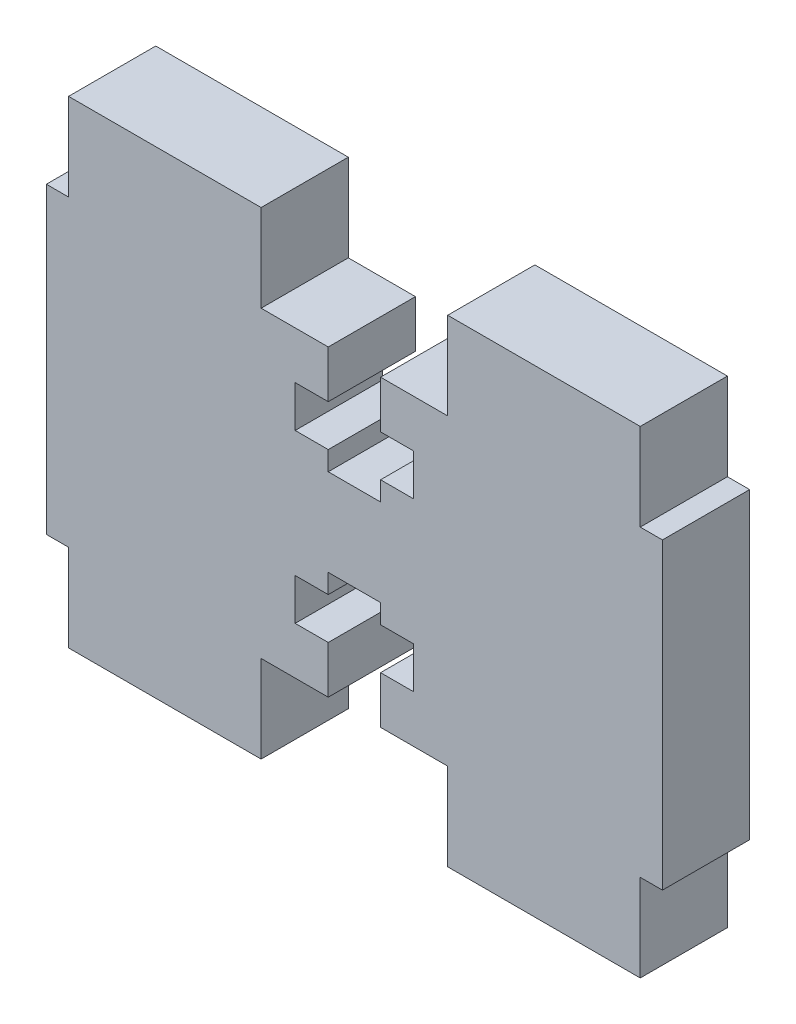
from build123d import *

# Parameters (mm, degrees)
BOSS_EXTRUDE1_DEPTH = 5.842


with BuildPart() as part:
    # Sketch1 → Boss-Extrude1 (new body)
    with BuildSketch(Plane.XY):
        Polygon((-19.15, 10.16), (-20.6375, 10.16), (-20.6375, -10.16), (-19.15, -10.16), (-19.15, -16.002), (-6.25, -16.002), (-6.25, -10.16), (-1.7526, -10.16), (-1.7526, -6.985), (-3.96875, -6.985), (-3.96875, -4.206875), (-1.7526, -4.206875), (-1.7526, -2.917875), (1.7526, -2.917875), (1.7526, -4.206875), (3.96875, -4.206875), (3.96875, -6.985), (1.7526, -6.985), (1.7526, -10.16), (6.25, -10.16), (6.25, -16.002), (19.15, -16.002), (19.15, -10.16), (20.6375, -10.16), (20.6375, 10.16), (19.15, 10.16), (19.15, 16.002), (6.25, 16.002), (6.25, 10.16), (1.7526, 10.16), (1.7526, 6.985), (3.96875, 6.985), (3.96875, 4.206875), (1.7526, 4.206875), (1.7526, 2.917875), (-1.7526, 2.917875), (-1.7526, 4.206875), (-3.96875, 4.206875), (-3.96875, 6.985), (-1.7526, 6.985), (-1.7526, 10.16), (-6.25, 10.16), (-6.25, 16.002), (-19.15, 16.002), align=None)
    extrude(amount=BOSS_EXTRUDE1_DEPTH)


solid = part.part
